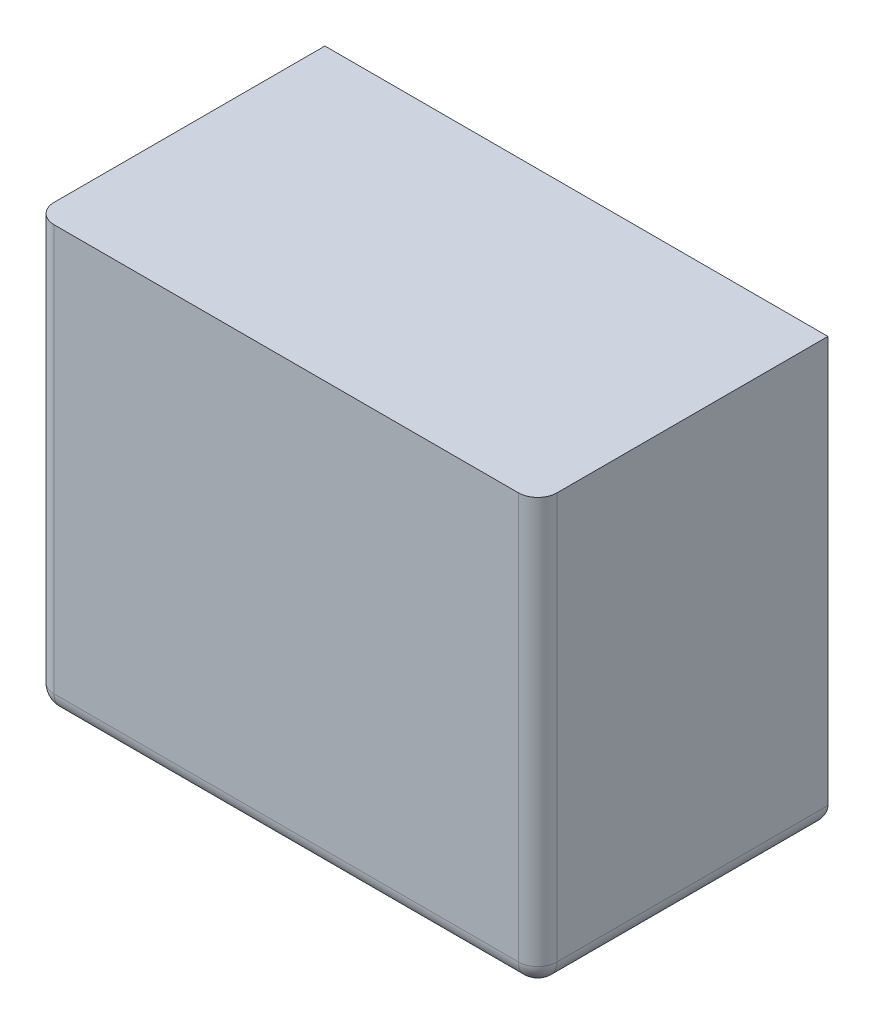
from build123d import *

# Parameters (mm, degrees)
SKETCH2_W           = 260
SKETCH2_H           = 220
BOSS_EXTRUDE1_DEPTH = 150
FILLET1_R           = 10


with BuildPart() as part:
    # Sketch2 → Boss-Extrude1 (new body)
    with BuildSketch(Plane.XY):
        with Locations((130, -110)):
            Rectangle(SKETCH2_W, SKETCH2_H)
    extrude(amount=BOSS_EXTRUDE1_DEPTH)

    # Fillet1
    fillet1_edges = [part.edges().sort_by_distance(p)[0] for p in [
        (130, -220, 150),
        (260, -110, 150),
        (130, -220, 0),
        (260, -220, 75),
        (0, -220, 75),
        (0, -110, 150),
    ]]
    fillet(fillet1_edges, radius=FILLET1_R)


solid = part.part
